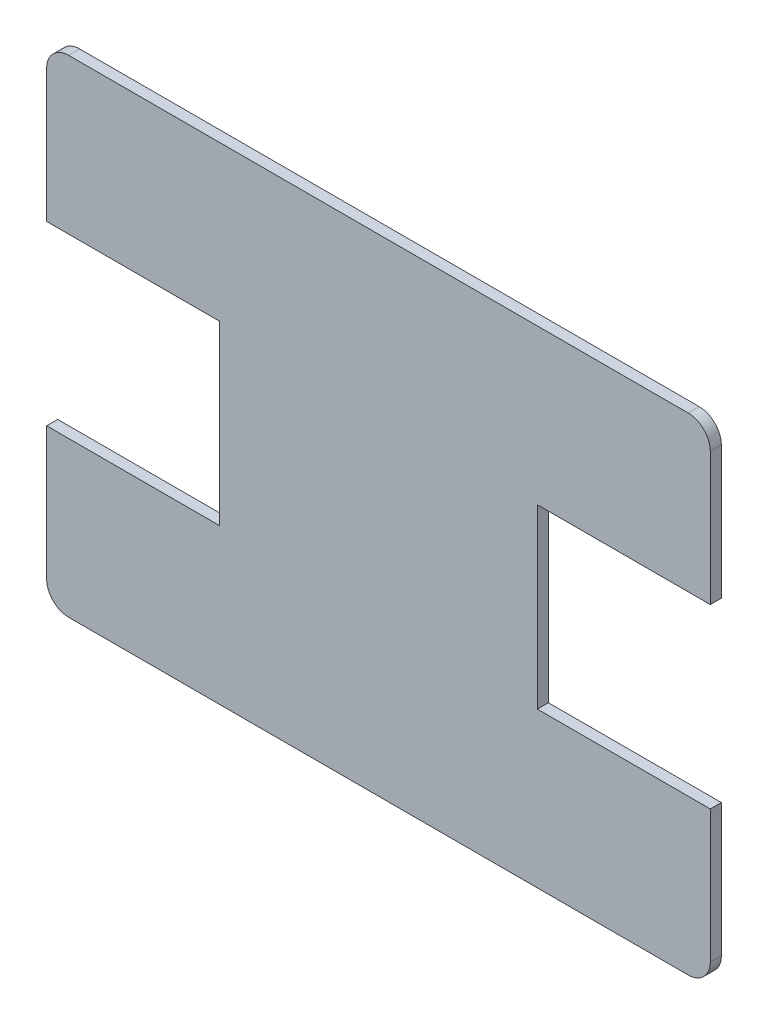
from build123d import *

# Parameters (mm, degrees)
BOSS_EXTRUDE1_DEPTH = 5


with BuildPart() as part:
    # Sketch1 → Boss-Extrude1 (new body)
    with BuildSketch(Plane.XY):
        with BuildLine():
            Line((-150, 40), (-71.83, 40))
            Line((-71.83, 40), (-71.83, -40))
            Line((-71.83, -40), (-150, -40))
            Line((-150, -40), (-150, -100))
            ThreePointArc((-150, -100), (-147.071067812, -107.071067812), (-140, -110))
            Line((-140, -110), (140, -110))
            ThreePointArc((140, -110), (147.071067812, -107.071067812), (150, -100))
            Line((150, -100), (150, -40))
            Line((150, -40), (71.83, -40))
            Line((71.83, -40), (71.83, 40))
            Line((71.83, 40), (150, 40))
            Line((150, 40), (150, 100))
            ThreePointArc((150, 100), (147.071067812, 107.071067812), (140, 110))
            Line((140, 110), (-140, 110))
            ThreePointArc((-140, 110), (-147.071067812, 107.071067812), (-150, 100))
            Line((-150, 100), (-150, 40))
        make_face()
    extrude(amount=BOSS_EXTRUDE1_DEPTH)


solid = part.part
